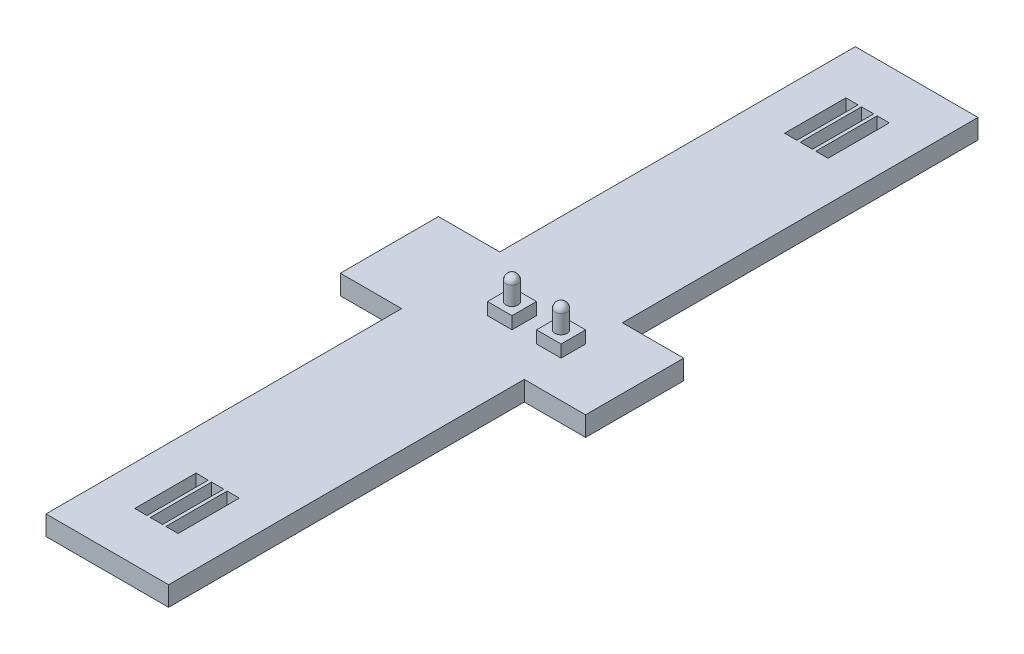
from build123d import *

# Parameters (mm, degrees)
SKETCH2_W           = 10
SKETCH2_H           = 66
BOSS_EXTRUDE1_DEPTH = 1.6
CUT_EXTRUDE1_REACH  = 35.415
SKETCH3_W           = 1
SKETCH3_H           = 5
SKETCH4_W           = 20
SKETCH4_H           = 8
BOSS_EXTRUDE2_DEPTH = 1.6
SKETCH5_W           = 2
SKETCH5_H           = 2
BOSS_EXTRUDE3_DEPTH = 1
SKETCH6_R           = 0.5
BOSS_EXTRUDE4_DEPTH = 2
FILLET1_R           = 0.5


with BuildPart() as part:
    # Sketch2 → Boss-Extrude1 (new body)
    with BuildSketch(Plane(origin=(0, 0, 0), x_dir=(1, 0, 0), z_dir=(0, 1, 0))):
        Rectangle(SKETCH2_W, SKETCH2_H)
    extrude(amount=BOSS_EXTRUDE1_DEPTH)

    # Sketch3 → Cut-Extrude1 (cut, up to next)
    with BuildSketch(Plane(origin=(0, 1.6, 0), x_dir=(1, 0, 0), z_dir=(0, 1, 0)), mode=Mode.PRIVATE) as cut_extrude1_sk1:
        with Locations((1.27, 26.5)):
            Rectangle(SKETCH3_W, SKETCH3_H)
    cut_extrude1_tool1 = extrude(cut_extrude1_sk1.sketch, amount=-CUT_EXTRUDE1_REACH, mode=Mode.PRIVATE) & part.part
    # Sketch3 → Cut-Extrude1 (cut, up to next)
    with BuildSketch(Plane(origin=(0, 1.6, 0), x_dir=(1, 0, 0), z_dir=(0, 1, 0)), mode=Mode.PRIVATE) as cut_extrude1_sk2:
        with Locations((0, 26.5)):
            Rectangle(SKETCH3_W, SKETCH3_H)
    cut_extrude1_tool2 = extrude(cut_extrude1_sk2.sketch, amount=-CUT_EXTRUDE1_REACH, mode=Mode.PRIVATE) & part.part
    # Sketch3 → Cut-Extrude1 (cut, up to next)
    with BuildSketch(Plane(origin=(0, 1.6, 0), x_dir=(1, 0, 0), z_dir=(0, 1, 0)), mode=Mode.PRIVATE) as cut_extrude1_sk3:
        with Locations((-1.27, 26.5)):
            Rectangle(SKETCH3_W, SKETCH3_H)
    cut_extrude1_tool3 = extrude(cut_extrude1_sk3.sketch, amount=-CUT_EXTRUDE1_REACH, mode=Mode.PRIVATE) & part.part
    # Sketch3 → Cut-Extrude1 (cut, up to next)
    with BuildSketch(Plane(origin=(0, 1.6, 0), x_dir=(1, 0, 0), z_dir=(0, 1, 0)), mode=Mode.PRIVATE) as cut_extrude1_sk4:
        with Locations((-1.27, -26.5)):
            Rectangle(SKETCH3_W, SKETCH3_H)
    cut_extrude1_tool4 = extrude(cut_extrude1_sk4.sketch, amount=-CUT_EXTRUDE1_REACH, mode=Mode.PRIVATE) & part.part
    # Sketch3 → Cut-Extrude1 (cut, up to next)
    with BuildSketch(Plane(origin=(0, 1.6, 0), x_dir=(1, 0, 0), z_dir=(0, 1, 0)), mode=Mode.PRIVATE) as cut_extrude1_sk5:
        with Locations((1.27, -26.5)):
            Rectangle(SKETCH3_W, SKETCH3_H)
    cut_extrude1_tool5 = extrude(cut_extrude1_sk5.sketch, amount=-CUT_EXTRUDE1_REACH, mode=Mode.PRIVATE) & part.part
    # Sketch3 → Cut-Extrude1 (cut, up to next)
    with BuildSketch(Plane(origin=(0, 1.6, 0), x_dir=(1, 0, 0), z_dir=(0, 1, 0)), mode=Mode.PRIVATE) as cut_extrude1_sk6:
        with Locations((0, -26.5)):
            Rectangle(SKETCH3_W, SKETCH3_H)
    cut_extrude1_tool6 = extrude(cut_extrude1_sk6.sketch, amount=-CUT_EXTRUDE1_REACH, mode=Mode.PRIVATE) & part.part
    add(cut_extrude1_tool1.solids().sort_by_distance((1.27, 1.6, -26.5))[0], mode=Mode.SUBTRACT)
    add(cut_extrude1_tool2.solids().sort_by_distance((0, 1.6, -26.5))[0], mode=Mode.SUBTRACT)
    add(cut_extrude1_tool3.solids().sort_by_distance((-1.27, 1.6, -26.5))[0], mode=Mode.SUBTRACT)
    add(cut_extrude1_tool4.solids().sort_by_distance((-1.27, 1.6, 26.5))[0], mode=Mode.SUBTRACT)
    add(cut_extrude1_tool5.solids().sort_by_distance((1.27, 1.6, 26.5))[0], mode=Mode.SUBTRACT)
    add(cut_extrude1_tool6.solids().sort_by_distance((0, 1.6, 26.5))[0], mode=Mode.SUBTRACT)

    # Sketch4 → Boss-Extrude2 (add)
    with BuildSketch(Plane.XZ):
        Rectangle(SKETCH4_W, SKETCH4_H)
    extrude(amount=-BOSS_EXTRUDE2_DEPTH)

    # Sketch5 → Boss-Extrude3 (add)
    with BuildSketch(Plane(origin=(0, 1.6, 0), x_dir=(1, 0, 0), z_dir=(0, 1, 0))):
        Rectangle(SKETCH5_W, SKETCH5_H)
        with Locations((4, 0)):
            Rectangle(SKETCH5_W, SKETCH5_H)
    extrude(amount=BOSS_EXTRUDE3_DEPTH)

    # Sketch6 → Boss-Extrude4 (add)
    with BuildSketch(Plane(origin=(0, 2.6, 0), x_dir=(1, 0, 0), z_dir=(0, 1, 0))):
        with Locations(Location((0, 0, 0), (0, 0, 270))):
            Circle(SKETCH6_R)
        with Locations(Location((4, 0, 0), (0, 0, 270))):
            Circle(SKETCH6_R)
    extrude(amount=BOSS_EXTRUDE4_DEPTH)

    # Fillet1
    fillet1_edges = [part.edges().sort_by_distance(p)[0] for p in [
        (0, 4.6, -0.5),
        (4, 4.6, -0.5),
    ]]
    fillet(fillet1_edges, radius=FILLET1_R)


solid = part.part
